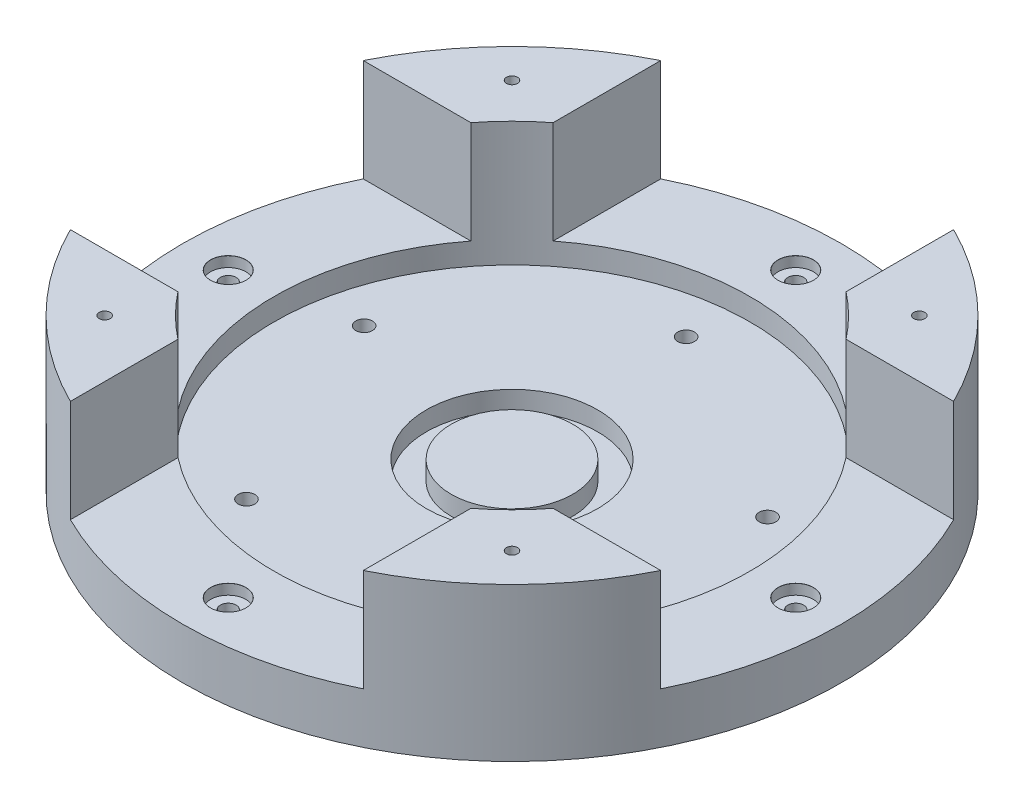
from build123d import *
from build123d.topology import SkipClean

# Parameters (mm, degrees)
SKETCH1_W                                        = 300
SKETCH1_H                                        = 300
BOSS_EXTRUDE1_DEPTH                              = 10
SKETCH2_R                                        = 127
BOSS_EXTRUDE2_DEPTH                              = 53.594
SKETCH4_R                                        = 122
CUT_EXTRUDE1_DEPTH                               = 3
CBORE_FOR_M6_HEX_HEAD_BOLT1_D                    = 6.6
CBORE_FOR_M6_HEX_HEAD_BOLT1_CBORE_D              = 14.55
CBORE_FOR_M6_HEX_HEAD_BOLT1_CBORE_DEPTH          = 4.38
FILLET1_R                                        = 10
FILLET2_R                                        = 2
SKETCH8_R                                        = 122
CUT_EXTRUDE2_DEPTH                               = 50.594
SKETCH10_R                                       = 114.3
SKETCH10_R_2                                     = 82.55
BOSS_EXTRUDE3_DEPTH                              = 43.18
CUT_EXTRUDE3_DEPTH                               = 25.4
CUT_EXTRUDE3_DEPTH_BACK                          = 15.24
SKETCH12_R                                       = 1.905
CUT_EXTRUDE4_DEPTH                               = 5.08
CBORE_FOR_M5_HEX_HEAD_MACHINE_SCREW1_D           = 5.8
CBORE_FOR_M5_HEX_HEAD_MACHINE_SCREW1_CBORE_D     = 11.71
CBORE_FOR_M5_HEX_HEAD_MACHINE_SCREW1_CBORE_DEPTH = 3.8
SKETCH16_R                                       = 29.718
SKETCH16_R_2                                     = 21.082
CUT_EXTRUDE5_DEPTH                               = 6.604
CUT_EXTRUDE6_DEPTH                               = 219.797433408
CUT_EXTRUDE6_DEPTH_BACK                          = 219.797433408
SKETCH17_R                                       = 254
SKETCH17_R_2                                     = 127
CUT_EXTRUDE7_START                               = -15.24
CUT_EXTRUDE7_DEPTH                               = 15.24
CUT_EXTRUDE8_START                               = -20.32
CUT_EXTRUDE8_DEPTH                               = 20.32
CBORE_FOR_M5_HEX_HEAD_BOLT1_AT_2_COUNT           = 2
CBORE_FOR_M5_HEX_HEAD_BOLT1_AT_2_PITCH           = 196.85
CBORE_FOR_M5_HEX_HEAD_BOLT1_AT_3_COUNT           = 2
CBORE_FOR_M5_HEX_HEAD_BOLT1_AT_3_PITCH           = 139.193969877
CBORE_FOR_M5_HEX_HEAD_BOLT1_AT_4_COUNT           = 2
CBORE_FOR_M5_HEX_HEAD_BOLT1_AT_4_PITCH           = 139.193969877
CUT_EXTRUDE9_DEPTH                               = 188.430832138
CUT_EXTRUDE9_DEPTH_BACK                          = 188.430832138
SKETCH22_R                                       = 139.7
SKETCH22_R_2                                     = 114.3


with BuildPart() as part:
    # Sketch1 → Boss-Extrude1 (new body)
    with BuildSketch(Plane(origin=(0, 0, 0), x_dir=(1, 0, 0), z_dir=(0, 1, 0))):
        Rectangle(SKETCH1_W, SKETCH1_H)
    extrude(amount=BOSS_EXTRUDE1_DEPTH)

    # Sketch2 → Boss-Extrude2 (add)
    with BuildSketch(Plane(origin=(0, 10, 0), x_dir=(1, 0, 0), z_dir=(0, 1, 0))):
        with Locations(Location((0, 0, 0), (0, 0, 270))):
            Circle(SKETCH2_R)
    extrude(amount=BOSS_EXTRUDE2_DEPTH)

    # Sketch4 → Cut-Extrude1 (cut)
    with BuildSketch(Plane(origin=(0, 63.594, 0), x_dir=(1, 0, 0), z_dir=(0, 1, 0))):
        with Locations(Location((0, 0, 0), (0, 0, 270))):
            Circle(SKETCH4_R)
    extrude(amount=-CUT_EXTRUDE1_DEPTH, mode=Mode.SUBTRACT)

    # CBORE for M6 Hex Head Bolt1 (through all)
    with Locations(Plane(origin=(0, 10, 0), x_dir=(1, 0, 0), z_dir=(0, 1, 0))):
        with Locations((-101.6, 101.6), (101.6, 101.6), (101.6, -101.6), (-101.6, -101.6)):
            CounterBoreHole(CBORE_FOR_M6_HEX_HEAD_BOLT1_D / 2, CBORE_FOR_M6_HEX_HEAD_BOLT1_CBORE_D / 2, CBORE_FOR_M6_HEX_HEAD_BOLT1_CBORE_DEPTH)

    # Fillet1
    fillet1_edges = [part.edges().sort_by_distance(p)[0] for p in [
        (150, 5, 150),
        (-150, 5, 150),
        (-150, 5, -150),
        (150, 5, -150),
    ]]
    fillet(fillet1_edges, radius=FILLET1_R)

    # Fillet2
    fillet2_edges = [part.edges().sort_by_distance(p)[0] for p in [
        (150, 10, 0),
        (0, 10, 150),
        (0, 10, -150),
        (-150, 10, 0),
        (-147.071067812, 10, 147.071067812),
        (147.071067812, 10, -147.071067812),
        (-147.071067812, 10, -147.071067812),
        (147.071067812, 10, 147.071067812),
    ]]
    fillet(fillet2_edges, radius=FILLET2_R)

    # Sketch8 → Cut-Extrude2 (cut)
    with BuildSketch(Plane(origin=(0, 60.594, 0), x_dir=(1, 0, 0), z_dir=(0, 1, 0))):
        with Locations(Location((0, 0, 0), (0, 0, 270))):
            Circle(SKETCH8_R)
    extrude(amount=-CUT_EXTRUDE2_DEPTH, mode=Mode.SUBTRACT)

    # Sketch10 → Boss-Extrude3 (add)
    with BuildSketch(Plane(origin=(0, 10, 0), x_dir=(1, 0, 0), z_dir=(0, 1, 0))):
        with Locations(Location((0, 0, 0), (0, 0, 270))):
            Circle(SKETCH10_R)
        with Locations(Location((0, 0, 0), (0, 0, 270))):
            Circle(SKETCH10_R_2, mode=Mode.SUBTRACT)
    extrude(amount=BOSS_EXTRUDE3_DEPTH)

    # Sketch11 → Cut-Extrude3 (cut, two sides: drawn at the far end of the back side and taken through both)
    with BuildSketch(Plane(origin=(0, 53.18, 0), x_dir=(1, 0, 0), z_dir=(0, 1, 0)).offset(-CUT_EXTRUDE3_DEPTH_BACK)):
        Polygon((25.4, 25.4), (139.7, 25.4), (139.7, -25.4), (25.4, -25.4), (25.4, -139.7), (-25.4, -139.7), (-25.4, -25.4), (-139.7, -25.4), (-139.7, 25.4), (-25.4, 25.4), (-25.4, 139.7), (25.4, 139.7), align=None)
    extrude(amount=CUT_EXTRUDE3_DEPTH + CUT_EXTRUDE3_DEPTH_BACK, mode=Mode.SUBTRACT)

    # Sketch12 → Cut-Extrude4 (cut)
    with BuildSketch(Plane(origin=(0, 53.18, 0), x_dir=(1, 0, 0), z_dir=(0, 1, 0))):
        with Locations(Location((70.6501, 70.6501, 0), (0, 0, 270))):
            Circle(SKETCH12_R)
        with Locations(Location((-70.6501, 70.6501, 0), (0, 0, 270))):
            Circle(SKETCH12_R)
        with Locations(Location((-70.6501, -70.6501, 0), (0, 0, 270))):
            Circle(SKETCH12_R)
        with Locations(Location((70.6501, -70.6501, 0), (0, 0, 270))):
            Circle(SKETCH12_R)
    extrude(amount=-CUT_EXTRUDE4_DEPTH, mode=Mode.SUBTRACT)

    # CBORE for M5 Hex Head Machine Screw1 (through all)
    with Locations(Plane(origin=(0, 0, 0), x_dir=(-1, 0, 0), z_dir=(0, -1, 0))):
        with Locations((-44.699932873, -50.324468216), (-61.674452331, 26.961046525), (6.583025095, 66.98731134), (65.742985588, 14.439388698), (34.048374521, -58.063278348)):
            CounterBoreHole(CBORE_FOR_M5_HEX_HEAD_MACHINE_SCREW1_D / 2, CBORE_FOR_M5_HEX_HEAD_MACHINE_SCREW1_CBORE_D / 2, CBORE_FOR_M5_HEX_HEAD_MACHINE_SCREW1_CBORE_DEPTH)

    # Sketch16 → Cut-Extrude5 (cut)
    with BuildSketch(Plane(origin=(0, 10, 0), x_dir=(1, 0, 0), z_dir=(0, 1, 0))):
        with Locations(Location((0, 0, 0), (0, 0, 270))):
            Circle(SKETCH16_R)
        with Locations(Location((0, 0, 0), (0, 0, 270))):
            Circle(SKETCH16_R_2, mode=Mode.SUBTRACT)
    extrude(amount=-CUT_EXTRUDE5_DEPTH, mode=Mode.SUBTRACT)

    # Sketch17 → Cut-Extrude6 (cut, two sides: drawn at the far end of the back side and taken through both)
    with SkipClean():  # the faces are left unmerged after this step: merging them gives an invalid solid
        with BuildSketch(Plane(origin=(0, 10, 0), x_dir=(1, 0, 0), z_dir=(0, 1, 0)).offset(-CUT_EXTRUDE6_DEPTH_BACK)):
            Circle(SKETCH17_R)
            with Locations(Location((0, 0, 0), (0, 0, 101.536959033))):
                Circle(SKETCH17_R_2, mode=Mode.SUBTRACT)
        extrude(amount=CUT_EXTRUDE6_DEPTH + CUT_EXTRUDE6_DEPTH_BACK, mode=Mode.SUBTRACT)

    # Sketch18 → Cut-Extrude7 (cut)
    with SkipClean():  # the faces are left unmerged after this step: merging them gives an invalid solid
        with BuildSketch(Plane(origin=(0, 53.18, 0), x_dir=(1, 0, 0), z_dir=(0, 1, 0)).offset(CUT_EXTRUDE7_START)):
            with BuildLine():
                ThreePointArc((-65.068137364, -50.8), (-81.288406004, -14.376979843), (-78.545162168, 25.4))
                Line((-78.545162168, 25.4), (-111.44204772, 25.4))
                ThreePointArc((-111.44204772, 25.4), (-113.502062341, -13.482278897), (-102.390673403, -50.8))
                Line((-102.390673403, -50.8), (-65.068137364, -50.8))
            make_face()
            with BuildLine():
                ThreePointArc((-78.545162168, 25.4), (-72.921087146, 38.691311032), (-65.068137364, 50.8))
                Line((-65.068137364, 50.8), (-102.390673403, 50.8))
                ThreePointArc((-102.390673403, 50.8), (-107.667999683, 38.367849096), (-111.44204772, 25.4))
                Line((-111.44204772, 25.4), (-78.545162168, 25.4))
            make_face()
            with BuildLine():
                ThreePointArc((-50.8, 65.068137364), (-38.691311032, 72.921087146), (-25.4, 78.545162168))
                Line((-25.4, 78.545162168), (-25.4, 111.44204772))
                ThreePointArc((-25.4, 111.44204772), (-38.367849096, 107.667999683), (-50.8, 102.390673403))
                Line((-50.8, 102.390673403), (-50.8, 65.068137364))
            make_face()
            with BuildLine():
                ThreePointArc((-25.4, 78.545162168), (-12.856892374, 81.542644172), (0, 82.55))
                Line((0, 82.55), (0, 114.3))
                ThreePointArc((0, 114.3), (-12.78013978, 113.583264732), (-25.4, 111.44204772))
                Line((-25.4, 111.44204772), (-25.4, 78.545162168))
            make_face()
            with BuildLine():
                Line((0, 114.3), (0, 82.55))
                ThreePointArc((0, 82.55), (26.861941112, 78.057277814), (50.8, 65.068137364))
                Line((50.8, 65.068137364), (50.8, 102.390673403))
                ThreePointArc((50.8, 102.390673403), (26.088656826, 111.282846769), (0, 114.3))
            make_face()
            with BuildLine():
                Line((102.390673403, 50.8), (65.068137364, 50.8))
                ThreePointArc((65.068137364, 50.8), (82.55, 0), (65.068137364, -50.8))
                Line((65.068137364, -50.8), (102.390673403, -50.8))
                ThreePointArc((102.390673403, -50.8), (111.282846769, -26.088656826), (114.3, 0))
                ThreePointArc((114.3, 0), (111.282846769, 26.088656826), (102.390673403, 50.8))
            make_face()
            with BuildLine():
                Line((50.8, -102.390673403), (50.8, -65.068137364))
                ThreePointArc((50.8, -65.068137364), (0, -82.55), (-50.8, -65.068137364))
                Line((-50.8, -65.068137364), (-50.8, -102.390673403))
                ThreePointArc((-50.8, -102.390673403), (0, -114.3), (50.8, -102.390673403))
            make_face()
        extrude(amount=CUT_EXTRUDE7_DEPTH, mode=Mode.SUBTRACT)

    # Sketch19 → Cut-Extrude8 (cut)
    with SkipClean():  # the faces are left unmerged after this step: merging them gives an invalid solid
        with BuildSketch(Plane(origin=(0, 37.94, 0), x_dir=(1, 0, 0), z_dir=(0, 1, 0)).offset(CUT_EXTRUDE8_START)):
            with BuildLine():
                Line((50.8, -102.390673403), (50.8, -65.068137364))
                ThreePointArc((50.8, -65.068137364), (0, -82.55), (-50.8, -65.068137364))
                Line((-50.8, -65.068137364), (-50.8, -102.390673403))
                ThreePointArc((-50.8, -102.390673403), (0, -114.3), (50.8, -102.390673403))
            make_face()
            with BuildLine():
                Line((102.390673403, 50.8), (65.068137364, 50.8))
                ThreePointArc((65.068137364, 50.8), (82.55, 0), (65.068137364, -50.8))
                Line((65.068137364, -50.8), (102.390673403, -50.8))
                ThreePointArc((102.390673403, -50.8), (114.3, 0), (102.390673403, 50.8))
            make_face()
            with BuildLine():
                Line((-50.8, 102.390673403), (-50.8, 65.068137364))
                ThreePointArc((-50.8, 65.068137364), (0, 82.55), (50.8, 65.068137364))
                Line((50.8, 65.068137364), (50.8, 102.390673403))
                ThreePointArc((50.8, 102.390673403), (0, 114.3), (-50.8, 102.390673403))
            make_face()
            with BuildLine():
                Line((-102.390673403, -50.8), (-65.068137364, -50.8))
                ThreePointArc((-65.068137364, -50.8), (-82.55, 0), (-65.068137364, 50.8))
                Line((-65.068137364, 50.8), (-102.390673403, 50.8))
                ThreePointArc((-102.390673403, 50.8), (-114.3, 0), (-102.390673403, -50.8))
            make_face()
        extrude(amount=CUT_EXTRUDE8_DEPTH, mode=Mode.SUBTRACT)

    # Sketch21 → CBORE for M5 Hex Head Bolt1 (revolve, cut)
    with SkipClean():  # the faces are left unmerged after this step: merging them gives an invalid solid
        with BuildSketch(Plane(origin=(-98.425, 17.62, 0), x_dir=(0, 0, 1), z_dir=(1, 0, 0))):
            Polygon((0, 0), (0, 17.62), (2.75, 17.62), (2.75, 3.58), (6.12, 3.58), (6.12, 0.020977491), (6.145, 0), align=None)
        cbore_for_m5_hex_head_bolt1 = revolve(axis=Axis((-98.425, 23.97, 0), (0, -1, 0)), mode=Mode.SUBTRACT)

    # CBORE for M5 Hex Head Bolt1 at 2: CBORE for M5 Hex Head Bolt1 ×2
    with SkipClean():  # the faces are left unmerged after this step: merging them gives an invalid solid
        with Locations(*[(i * CBORE_FOR_M5_HEX_HEAD_BOLT1_AT_2_PITCH, 0, 0) for i in range(1, CBORE_FOR_M5_HEX_HEAD_BOLT1_AT_2_COUNT)]):
            add(cbore_for_m5_hex_head_bolt1, mode=Mode.SUBTRACT)

    # CBORE for M5 Hex Head Bolt1 at 3: CBORE for M5 Hex Head Bolt1 ×2
    with SkipClean():  # the faces are left unmerged after this step: merging them gives an invalid solid
        with Locations(*[Vector(0.7071067811865476, 0, -0.7071067811865476) * (i * CBORE_FOR_M5_HEX_HEAD_BOLT1_AT_3_PITCH) for i in range(1, CBORE_FOR_M5_HEX_HEAD_BOLT1_AT_3_COUNT)]):
            add(cbore_for_m5_hex_head_bolt1, mode=Mode.SUBTRACT)

    # CBORE for M5 Hex Head Bolt1 at 4: CBORE for M5 Hex Head Bolt1 ×2
    with SkipClean():  # the faces are left unmerged after this step: merging them gives an invalid solid
        with Locations(*[Vector(0.7071067811865476, 0, 0.7071067811865476) * (i * CBORE_FOR_M5_HEX_HEAD_BOLT1_AT_4_PITCH) for i in range(1, CBORE_FOR_M5_HEX_HEAD_BOLT1_AT_4_COUNT)]):
            add(cbore_for_m5_hex_head_bolt1, mode=Mode.SUBTRACT)

    # Sketch22 → Cut-Extrude9 (cut, two sides: drawn at the far end of the back side and taken through both)
    with SkipClean():  # the faces are left unmerged after this step: merging them gives an invalid solid
        with BuildSketch(Plane(origin=(0, 10, 0), x_dir=(1, 0, 0), z_dir=(0, 1, 0)).offset(-CUT_EXTRUDE9_DEPTH_BACK)):
            Circle(SKETCH22_R)
            with Locations(Location((0, 0, 0), (0, 0, 116.387799961))):
                Circle(SKETCH22_R_2, mode=Mode.SUBTRACT)
        extrude(amount=CUT_EXTRUDE9_DEPTH + CUT_EXTRUDE9_DEPTH_BACK, mode=Mode.SUBTRACT)


solid = part.part
